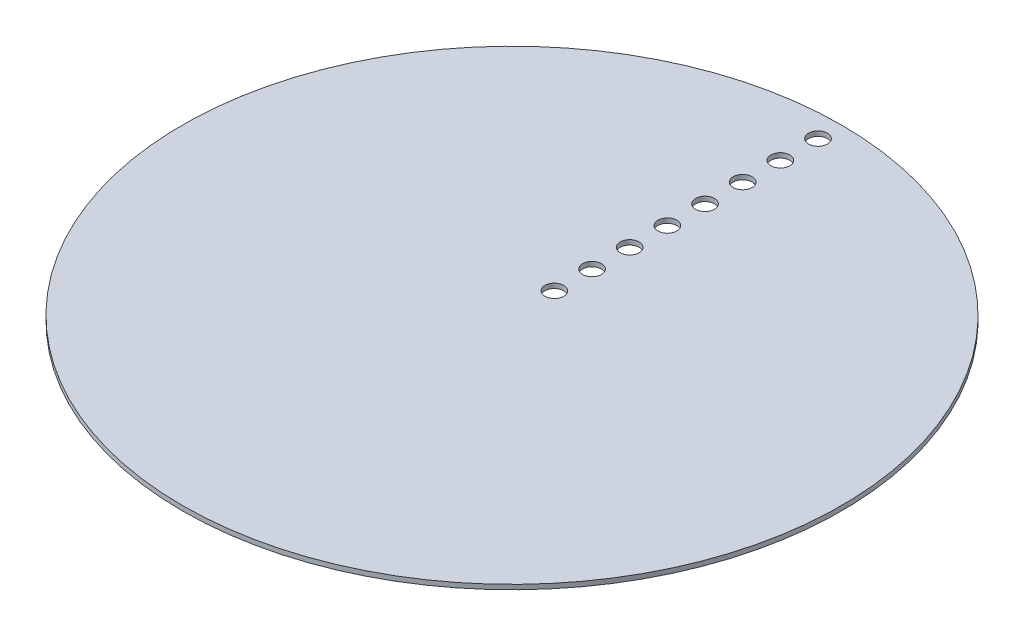
from build123d import *

# Parameters (mm, degrees)
SKETCH1_R           = 70
BOSS_EXTRUDE1_DEPTH = 1
SKETCH2_R           = 2
CUT_EXTRUDE1_DEPTH  = 1


with BuildPart() as part:
    # Sketch1 → Boss-Extrude1 (new body)
    with BuildSketch(Plane(origin=(0, 0, 0), x_dir=(1, 0, 0), z_dir=(0, 1, 0))):
        with Locations(Location((0, 0, 0), (0, 0, 270))):
            Circle(SKETCH1_R)
    extrude(amount=BOSS_EXTRUDE1_DEPTH)

    # Sketch2 → Cut-Extrude1 (cut)
    with BuildSketch(Plane(origin=(0, 1, 0), x_dir=(1, 0, 0), z_dir=(0, 1, 0))):
        with Locations(Location((0, 9, 0), (0, 0, 270))):
            Circle(SKETCH2_R)
        with Locations(Location((0, 17, 0), (0, 0, 270))):
            Circle(SKETCH2_R)
        with Locations(Location((0, 25, 0), (0, 0, 270))):
            Circle(SKETCH2_R)
        with Locations(Location((0, 33, 0), (0, 0, 270))):
            Circle(SKETCH2_R)
        with Locations(Location((0, 41, 0), (0, 0, 270))):
            Circle(SKETCH2_R)
        with Locations(Location((0, 49, 0), (0, 0, 270))):
            Circle(SKETCH2_R)
        with Locations(Location((0, 57, 0), (0, 0, 270))):
            Circle(SKETCH2_R)
        with Locations(Location((0, 65, 0), (0, 0, 270))):
            Circle(SKETCH2_R)
    extrude(amount=-CUT_EXTRUDE1_DEPTH, mode=Mode.SUBTRACT)


solid = part.part
